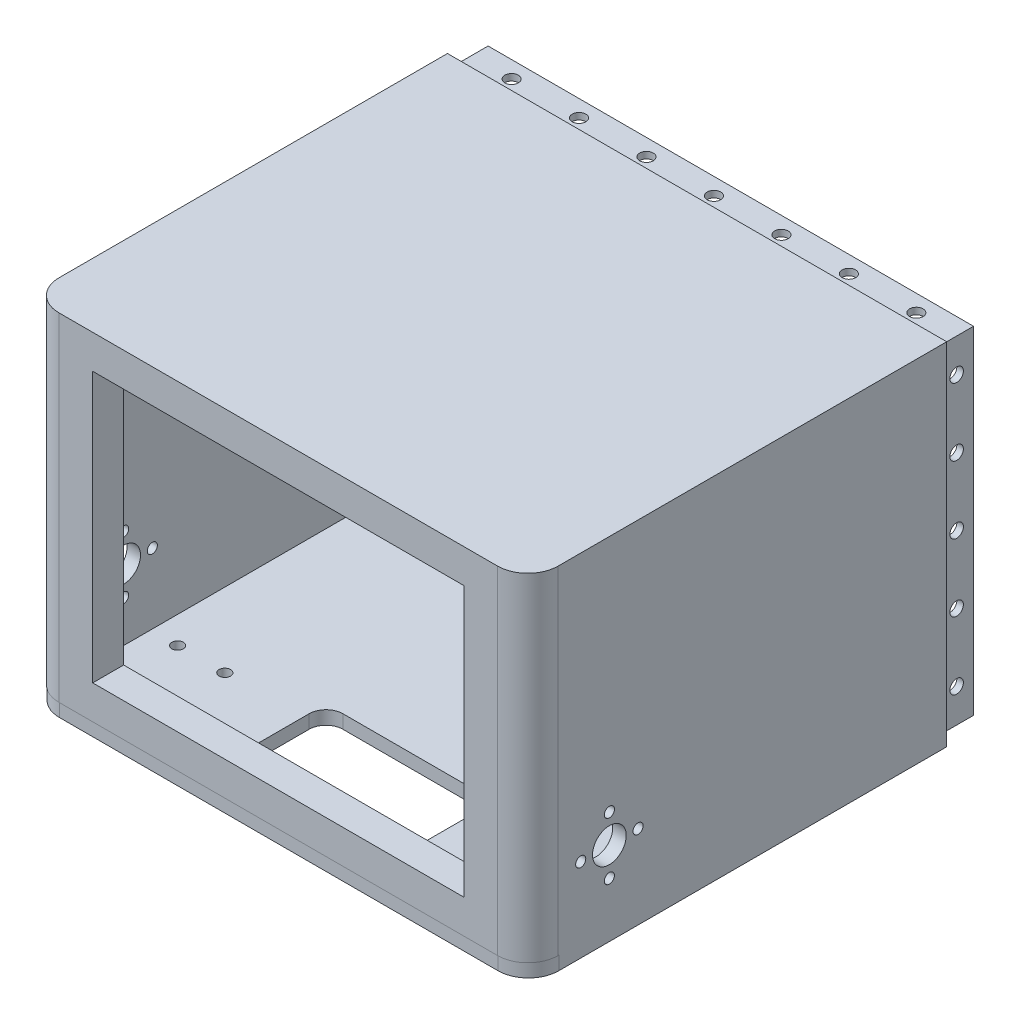
from build123d import *

# Parameters (mm, degrees)
SKETCH_1_R                = 1.7
EXTRUDE_6_DEPTH           = 4
EXTRUDE_7_DEPTH           = 100
SKETCH_10_W               = 140
SKETCH_10_H               = 96
CUT_EXTRUDE_20_DEPTH      = 115
CUT_EXTRUDE_22_DEPTH      = 220.402235989
CUT_EXTRUDE_22_DEPTH_BACK = 220.402235989
SKETCH_16_R               = 1.5
SKETCH_16_R_2             = 4
SKETCH_21_W               = 110
SKETCH_21_H               = 80
CUT_EXTRUDE_28_DEPTH      = 50
SKETCH_23_R               = 5
CUT_EXTRUDE_29_DEPTH      = 220.402235989
SKETCH_31_W               = 143.9
SKETCH_31_H               = 99.9
SKETCH_31_W_2             = 140
SKETCH_31_H_2             = 96
EXTRUDE_9_DEPTH           = 10
CUT_EXTRUDE_32_DEPTH      = 177.881722224
CUT_EXTRUDE_32_DEPTH_BACK = 177.881722224
SKETCH_32_R               = 2
CUT_EXTRUDE_33_DEPTH      = 219.024640022
CUT_EXTRUDE_33_DEPTH_BACK = 219.024640022
SKETCH_33_R               = 2


with BuildPart() as part:
    # 草图1 → 凸台-拉伸6 (new body)
    with BuildSketch(Plane(origin=(0, 0, 0), x_dir=(1, 0, 0), z_dir=(0, 1, 0))):
        with BuildLine():
            Line((-74, 0), (-74, -115))
            ThreePointArc((-74, -115), (-71.363961031, -121.363961031), (-65, -124))
            Line((-65, -124), (65, -124))
            ThreePointArc((65, -124), (71.363961031, -121.363961031), (74, -115))
            Line((74, -115), (74, 0))
            Line((74, 0), (-74, 0))
        make_face()
        with Locations(Location((-62, -108, 0), (0, 0, 270))):
            Circle(SKETCH_1_R, mode=Mode.SUBTRACT)
        with Locations(Location((-48, -108, 0), (0, 0, 270))):
            Circle(SKETCH_1_R, mode=Mode.SUBTRACT)
        with Locations(Location((48, -108, 0), (0, 0, 270))):
            Circle(SKETCH_1_R, mode=Mode.SUBTRACT)
        with Locations(Location((62, -108, 0), (0, 0, 270))):
            Circle(SKETCH_1_R, mode=Mode.SUBTRACT)
        with Locations(Location((-62, -92, 0), (0, 0, 270))):
            Circle(SKETCH_1_R, mode=Mode.SUBTRACT)
        with Locations(Location((-48, -92, 0), (0, 0, 270))):
            Circle(SKETCH_1_R, mode=Mode.SUBTRACT)
        with BuildLine():
            ThreePointArc((-25, -90), (-23.535533906, -86.464466094), (-20, -85))
            Line((-20, -85), (20, -85))
            ThreePointArc((20, -85), (23.535533906, -86.464466094), (25, -90))
            Line((25, -90), (25, -107.989151936))
            ThreePointArc((25, -107.989151936), (23.535533906, -111.524685842), (20, -112.989151936))
            Line((20, -112.989151936), (-20, -112.989151936))
            ThreePointArc((-20, -112.989151936), (-23.535533906, -111.524685842), (-25, -107.989151936))
            Line((-25, -107.989151936), (-25, -90))
        make_face(mode=Mode.SUBTRACT)
        with Locations(Location((48, -92, 0), (0, 0, 270))):
            Circle(SKETCH_1_R, mode=Mode.SUBTRACT)
        with Locations(Location((62, -92, 0), (0, 0, 270))):
            Circle(SKETCH_1_R, mode=Mode.SUBTRACT)
    extrude(amount=EXTRUDE_6_DEPTH)

    # 草图9 → 凸台-拉伸7 (add)
    with BuildSketch(Plane(origin=(0, 4, 0), x_dir=(1, 0, 0), z_dir=(0, 1, 0))):
        with BuildLine():
            Line((-74, 0), (74, 0))
            Line((74, 0), (74, -115.166586314))
            ThreePointArc((74, -115.166586314), (71.363961031, -121.530547345), (65, -124.166586314))
            Line((65, -124.166586314), (-65, -124.166586314))
            ThreePointArc((-65, -124.166586314), (-71.363961031, -121.530547345), (-74, -115.166586314))
            Line((-74, -115.166586314), (-74, 0))
        make_face()
    extrude(amount=EXTRUDE_7_DEPTH)

    # 草图10 → 切除-拉伸20 (cut)
    with BuildSketch(Plane(origin=(0, 0, 0), x_dir=(-1, 0, 0), z_dir=(0, 0, -1))):
        with Locations((0, 52)):
            Rectangle(SKETCH_10_W, SKETCH_10_H)
    extrude(amount=-CUT_EXTRUDE_20_DEPTH, mode=Mode.SUBTRACT)

    # 草图16 → 切除-拉伸22 (cut, two sides: drawn at the far end of the back side and taken through both)
    with BuildSketch(Plane.ZY.offset(74).offset(-CUT_EXTRUDE_22_DEPTH_BACK)):
        with Locations(Location((100, 16.25, 0), (0, 0, 180))):
            Circle(SKETCH_16_R)
        with Locations(Location((108.5, 24.75, 0), (0, 0, 180))):
            Circle(SKETCH_16_R)
        with Locations(Location((100, 24.75, 0), (0, 0, 180))):
            Circle(SKETCH_16_R_2)
        with Locations(Location((91.5, 24.75, 0), (0, 0, 180))):
            Circle(SKETCH_16_R)
        with Locations(Location((100, 33.25, 0), (0, 0, 180))):
            Circle(SKETCH_16_R)
    extrude(amount=CUT_EXTRUDE_22_DEPTH + CUT_EXTRUDE_22_DEPTH_BACK, mode=Mode.SUBTRACT)

    # 草图21 → 切除-拉伸28 (cut)
    with BuildSketch(Plane.XY.offset(124.166586314)):
        with Locations((0, 54)):
            Rectangle(SKETCH_21_W, SKETCH_21_H)
    extrude(amount=-CUT_EXTRUDE_28_DEPTH, mode=Mode.SUBTRACT)

    # 草图23 → 切除-拉伸29 (cut, through all)
    with BuildSketch(Plane.ZY.offset(74)):
        with Locations((100, 24.75)):
            Circle(SKETCH_23_R)
    extrude(amount=-CUT_EXTRUDE_29_DEPTH, mode=Mode.SUBTRACT)

    # 草图31 → 凸台-拉伸9 (add)
    with BuildSketch(Plane(origin=(0, 0, 0), x_dir=(-1, 0, 0), z_dir=(0, 0, -1))):
        with Locations((0, 52)):
            Rectangle(SKETCH_31_W, SKETCH_31_H)
        with Locations((0, 52)):
            Rectangle(SKETCH_31_W_2, SKETCH_31_H_2, mode=Mode.SUBTRACT)
    extrude(amount=EXTRUDE_9_DEPTH)

    # 草图32 → 切除-拉伸32 (cut, two sides: drawn at the far end of the back side and taken through both)
    with BuildSketch(Plane(origin=(0, 101.95, 0), x_dir=(1, 0, 0), z_dir=(0, 1, 0)).offset(-CUT_EXTRUDE_32_DEPTH_BACK)):
        with Locations(Location((0, 5, 0), (0, 0, 180))):
            Circle(SKETCH_32_R)
        with Locations(Location((20, 5, 0), (0, 0, 180))):
            Circle(SKETCH_32_R)
        with Locations(Location((40, 5, 0), (0, 0, 180))):
            Circle(SKETCH_32_R)
        with Locations(Location((60, 5, 0), (0, 0, 180))):
            Circle(SKETCH_32_R)
        with Locations(Location((-60, 5, 0), (0, 0, 180))):
            Circle(SKETCH_32_R)
        with Locations(Location((-20, 5, 0), (0, 0, 180))):
            Circle(SKETCH_32_R)
        with Locations(Location((-40, 5, 0), (0, 0, 180))):
            Circle(SKETCH_32_R)
    extrude(amount=CUT_EXTRUDE_32_DEPTH + CUT_EXTRUDE_32_DEPTH_BACK, mode=Mode.SUBTRACT)

    # 草图33 → 切除-拉伸33 (cut, two sides: drawn at the far end of the back side and taken through both)
    with BuildSketch(Plane.ZY.offset(71.95).offset(-CUT_EXTRUDE_33_DEPTH_BACK)):
        with Locations(Location((-5, 52, 0), (0, 0, 90))):
            Circle(SKETCH_33_R)
        with Locations(Location((-5, 72, 0), (0, 0, 90))):
            Circle(SKETCH_33_R)
        with Locations(Location((-5, 92, 0), (0, 0, 90))):
            Circle(SKETCH_33_R)
        with Locations(Location((-5, 12, 0), (0, 0, 90))):
            Circle(SKETCH_33_R)
        with Locations(Location((-5, 32, 0), (0, 0, 90))):
            Circle(SKETCH_33_R)
    extrude(amount=CUT_EXTRUDE_33_DEPTH + CUT_EXTRUDE_33_DEPTH_BACK, mode=Mode.SUBTRACT)


solid = part.part
